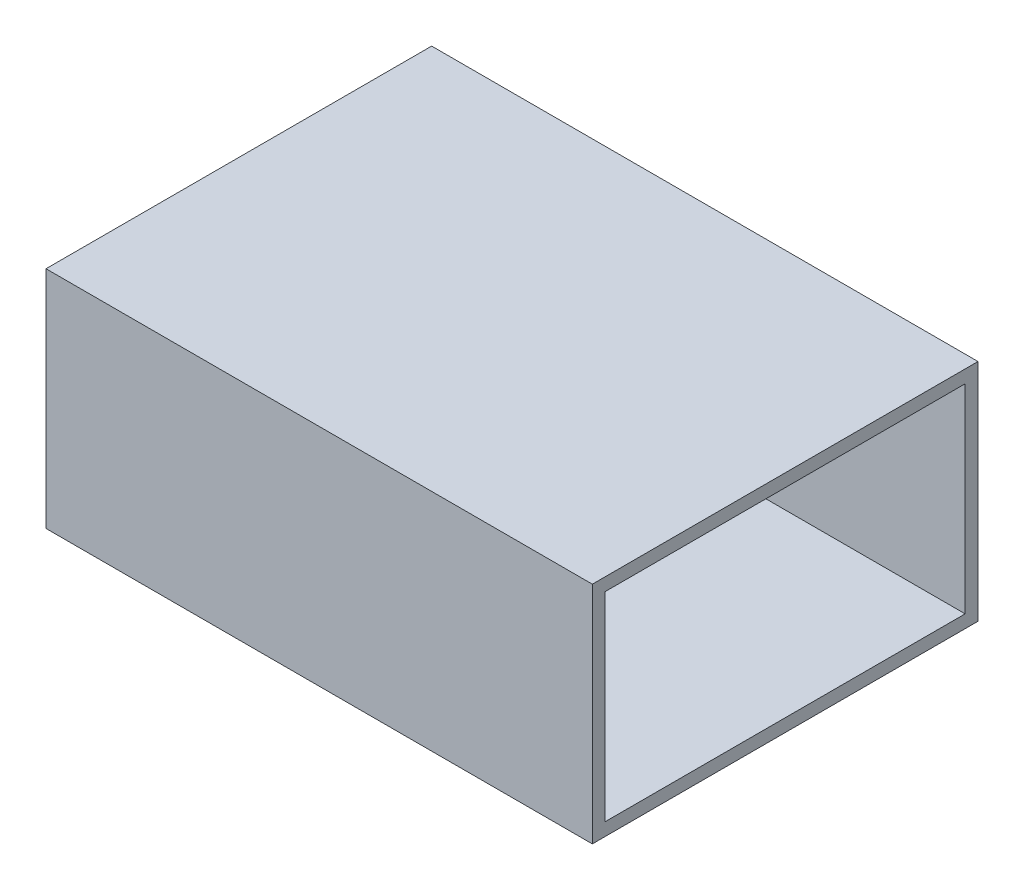
from build123d import *

# Parameters (mm, degrees)
SKETCH1_W           = 85
SKETCH1_H           = 60
BOSS_EXTRUDE1_DEPTH = 35
SKETCH2_W           = 56
SKETCH2_H           = 31
CUT_EXTRUDE1_DEPTH  = 80


with BuildPart() as part:
    # Sketch1 → Boss-Extrude1 (new body)
    with BuildSketch(Plane(origin=(0, 0, 0), x_dir=(1, 0, 0), z_dir=(0, 1, 0))):
        Rectangle(SKETCH1_W, SKETCH1_H)
    extrude(amount=BOSS_EXTRUDE1_DEPTH)

    # Sketch2 → Cut-Extrude1 (cut)
    with BuildSketch(Plane(origin=(42.5, 0, 0), x_dir=(0, 0, -1), z_dir=(1, 0, 0))):
        with Locations((0, 17.5)):
            Rectangle(SKETCH2_W, SKETCH2_H)
    extrude(amount=-CUT_EXTRUDE1_DEPTH, mode=Mode.SUBTRACT)


solid = part.part
